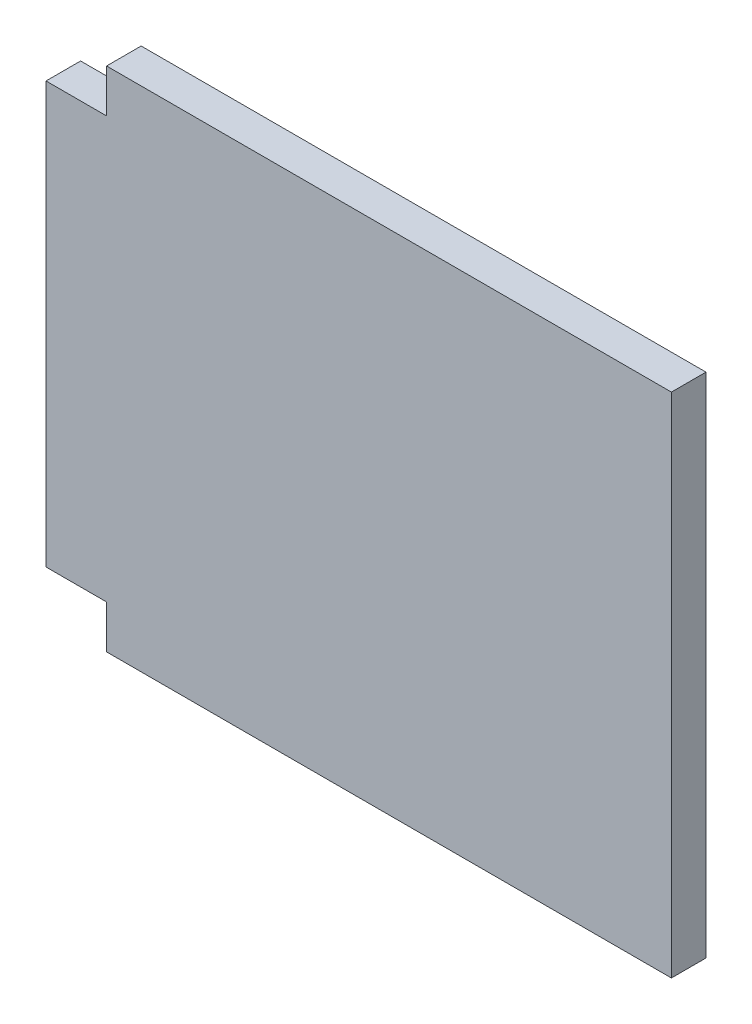
from build123d import *

# Parameters (mm, degrees)
ESQUISSE1_W        = 32.66
ESQUISSE1_H        = 29.34
ESQUISSE1_W_2      = 3.5
ESQUISSE1_H_2      = 24.34
BOSS_EXTRU_1_DEPTH = 2


with BuildPart() as part:
    # Esquisse1 → Boss.-Extru.1 (new body)
    with BuildSketch(Plane.XY):
        with Locations((-31.721560295, 17.58)):
            Rectangle(ESQUISSE1_W, ESQUISSE1_H)
        with Locations((-49.801560295, 17.58)):
            Rectangle(ESQUISSE1_W_2, ESQUISSE1_H_2)
    extrude(amount=BOSS_EXTRU_1_DEPTH)


solid = part.part
